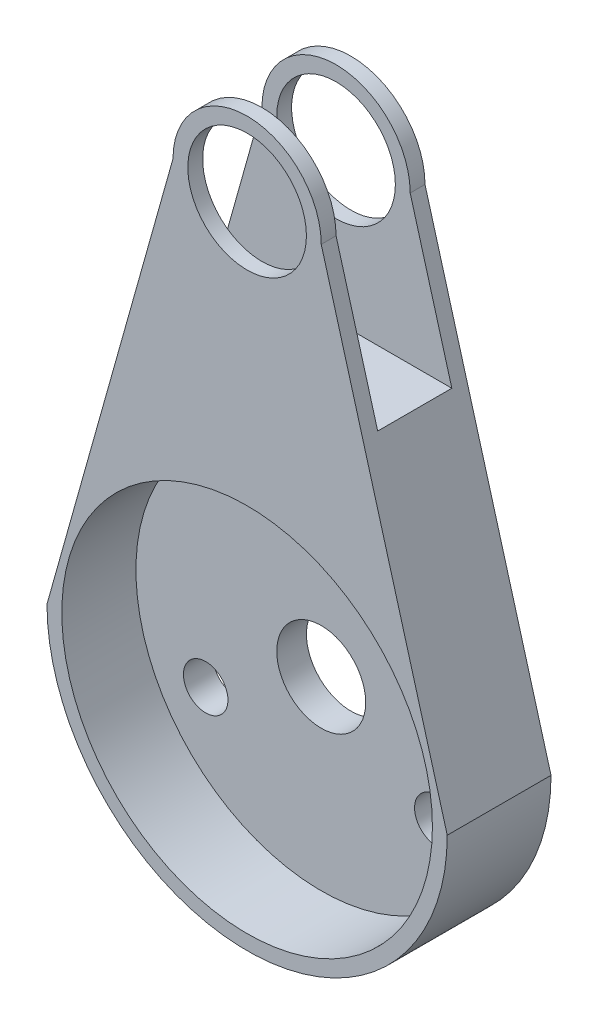
from build123d import *

# Parameters (mm, degrees)
BOSS_EXTRU_1_DEPTH      = 7
ESQUISSE2_R             = 3
ENL_V_MAT_EXTRU_1_DEPTH = 7
ESQUISSE3_R             = 1.5
ENL_V_MAT_EXTRU_2_DEPTH = 7
ESQUISSE4_R             = 4
ENL_V_MAT_EXTRU_3_DEPTH = 7
ESQUISSE5_R             = 12.5
ENL_V_MAT_EXTRU_4_DEPTH = 5
ESQUISSE6_W             = 27
ESQUISSE6_H             = 5
ENL_V_MAT_EXTRU_5_DEPTH = 20


with BuildPart() as part:
    # Esquisse1 → Boss.-Extru.1 (new body)
    with BuildSketch(Plane.XY):
        with BuildLine():
            Line((5, 0), (13.5, -30.265491901))
            ThreePointArc((13.5, -30.265491901), (0, -43.765491901), (-13.5, -30.265491901))
            Line((-13.5, -30.265491901), (-5, 0))
            ThreePointArc((-5, 0), (0, 5), (5, 0))
        make_face()
    extrude(amount=BOSS_EXTRU_1_DEPTH)

    # Esquisse2 → Enlèv. mat.-Extru.1 (cut)
    with BuildSketch(Plane.XY.offset(7)):
        with Locations((0, -30.265491901)):
            Circle(ESQUISSE2_R)
    extrude(amount=-ENL_V_MAT_EXTRU_1_DEPTH, mode=Mode.SUBTRACT)

    # Esquisse3 → Enlèv. mat.-Extru.2 (cut)
    with BuildSketch(Plane.XY.offset(7)):
        with Locations((0, -21.265491901)):
            Circle(ESQUISSE3_R)
        with Locations((-7.794228634, -34.765491901)):
            Circle(ESQUISSE3_R)
        with Locations((7.794228634, -34.765491901)):
            Circle(ESQUISSE3_R)
    extrude(amount=-ENL_V_MAT_EXTRU_2_DEPTH, mode=Mode.SUBTRACT)

    # Esquisse4 → Enlèv. mat.-Extru.3 (cut)
    with BuildSketch(Plane.XY.offset(7)):
        Circle(ESQUISSE4_R)
    extrude(amount=-ENL_V_MAT_EXTRU_3_DEPTH, mode=Mode.SUBTRACT)

    # Esquisse5 → Enlèv. mat.-Extru.4 (cut)
    with BuildSketch(Plane.XY.offset(7)):
        with Locations((0, -30.265491901)):
            Circle(ESQUISSE5_R)
    extrude(amount=-ENL_V_MAT_EXTRU_4_DEPTH, mode=Mode.SUBTRACT)

    # Esquisse6 → Enlèv. mat.-Extru.5 (cut)
    with BuildSketch(Plane(origin=(0, 10, 0), x_dir=(1, 0, 0), z_dir=(0, 1, 0))):
        with Locations((0, -3.5)):
            Rectangle(ESQUISSE6_W, ESQUISSE6_H)
    extrude(amount=-ENL_V_MAT_EXTRU_5_DEPTH, mode=Mode.SUBTRACT)


solid = part.part
